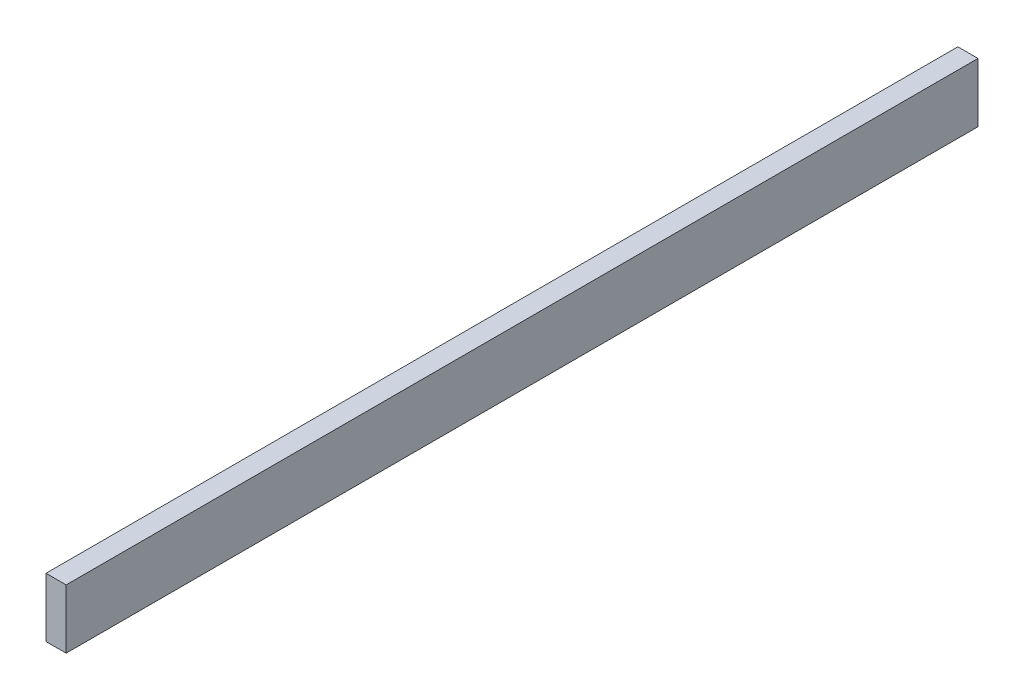
from build123d import *

# Parameters (mm, degrees)
SKETCH1_W           = 20.32
SKETCH1_H           = 59.69
BOSS_EXTRUDE1_DEPTH = 920.117999994


with BuildPart() as part:
    # Sketch1 → Boss-Extrude1 (new body)
    with BuildSketch(Plane.XY):
        Rectangle(SKETCH1_W, SKETCH1_H)
    extrude(amount=BOSS_EXTRUDE1_DEPTH)


solid = part.part
